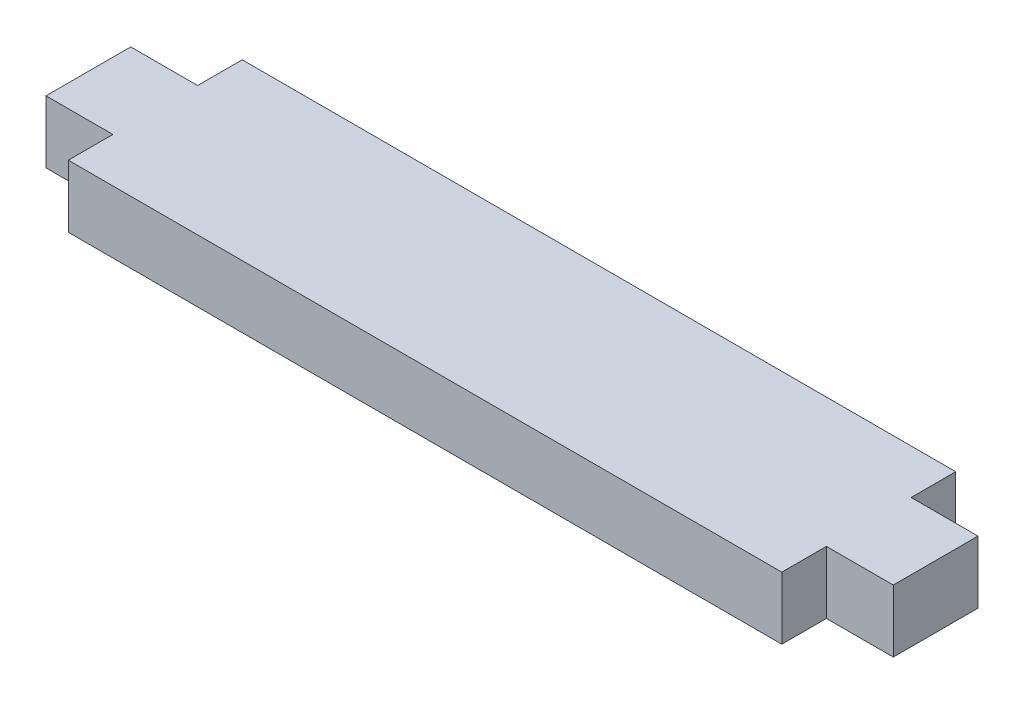
from build123d import *

# Parameters (mm, degrees)
SKETCH2_W           = 80
SKETCH2_H           = 7
BOSS_EXTRUDE1_DEPTH = 19.5
SKETCH3_W           = 7.5
SKETCH3_H           = 9.5
BOSS_EXTRUDE2_DEPTH = 7


with BuildPart() as part:
    # Sketch2 → Boss-Extrude1 (new body)
    with BuildSketch(Plane.XY):
        with Locations((40, -3.5)):
            Rectangle(SKETCH2_W, SKETCH2_H)
    extrude(amount=BOSS_EXTRUDE1_DEPTH)

    # Sketch3 → Boss-Extrude2 (add)
    with BuildSketch(Plane(origin=(0, 0, 0), x_dir=(1, 0, 0), z_dir=(0, 1, 0))):
        with Locations((-3.75, -9.75)):
            Rectangle(SKETCH3_W, SKETCH3_H)
        with Locations((83.75, -9.75)):
            Rectangle(SKETCH3_W, SKETCH3_H)
    extrude(amount=-BOSS_EXTRUDE2_DEPTH)


solid = part.part
